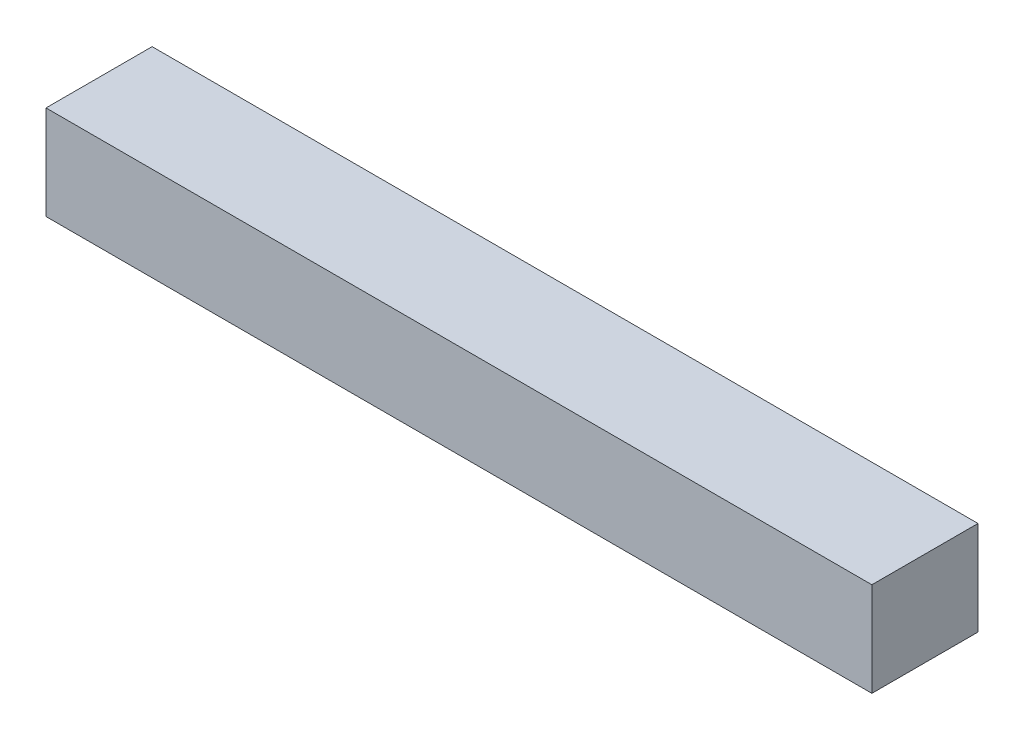
from build123d import *

# Parameters (mm, degrees)
SKETCH1_W           = 85.6
SKETCH1_H           = 11
BOSS_EXTRUDE1_DEPTH = 9.75


with BuildPart() as part:
    # Sketch1 → Boss-Extrude1 (new body)
    with BuildSketch(Plane(origin=(0, 0, 0), x_dir=(1, 0, 0), z_dir=(0, 1, 0))):
        with Locations((32.204682274, -0.036789298)):
            Rectangle(SKETCH1_W, SKETCH1_H)
    extrude(amount=BOSS_EXTRUDE1_DEPTH)


solid = part.part
